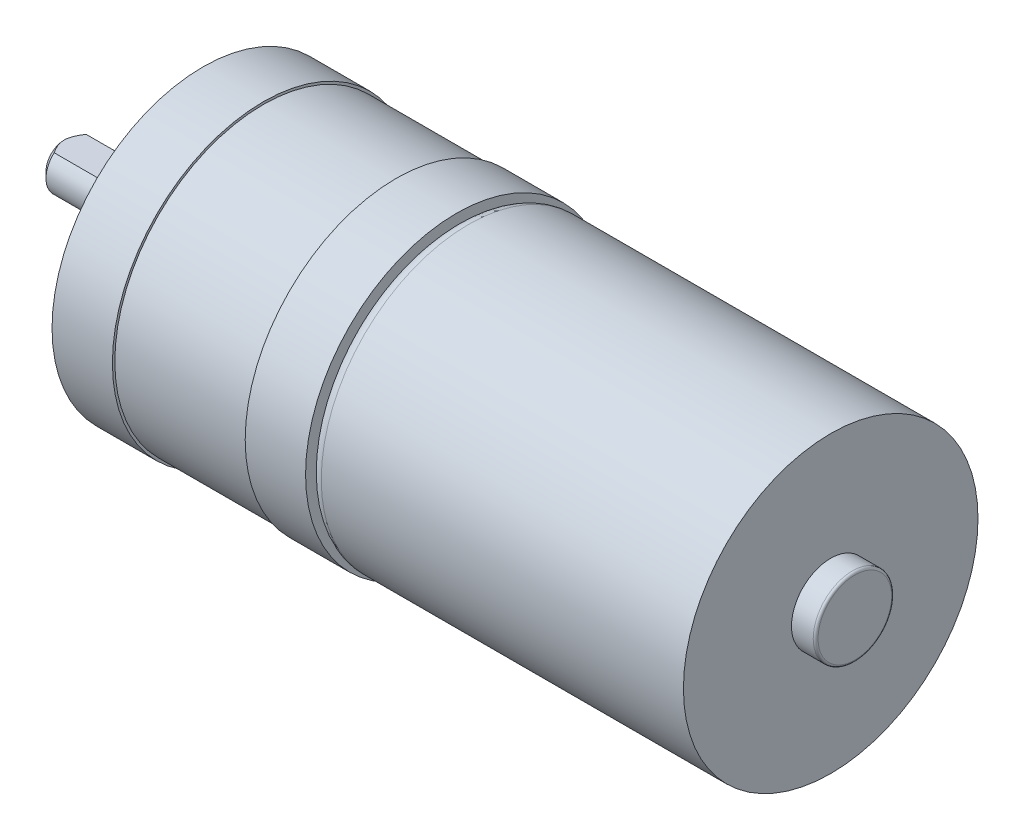
from build123d import *

# Parameters (mm, degrees)
CUT_EXTRUDE1_START = -8
CUT_EXTRUDE1_DEPTH = 8


with BuildPart() as part:
    # Sketch1 → Revolve1 (revolve)
    with BuildSketch(Plane.XY, mode=Mode.PRIVATE) as revolve1_sk:
        with BuildLine():
            Line((-9.946660926, -3.531651516), (-9.946660926, -12.5))
            Line((-9.946660926, -12.5), (-4.946660926, -12.5))
            Line((-4.946660926, -12.5), (-4.946660926, -12.3))
            Line((-4.946660926, -12.3), (6.053339074, -12.3))
            Line((6.053339074, -12.3), (6.053339074, -12.5))
            Line((6.053339074, -12.5), (11.053339074, -12.5))
            Line((11.053339074, -12.5), (11.053339074, -11.2))
            ThreePointArc((11.053339074, -11.2), (11.346232293, -11.907106781), (12.053339074, -12.2))
            Line((12.053339074, -12.2), (42.053339074, -12.2))
            Line((42.053339074, -12.2), (42.053339074, -3.25))
            Line((42.053339074, -3.25), (43.853339074, -3.25))
            ThreePointArc((43.853339074, -3.25), (43.99476043, -3.191421356), (44.053339074, -3.05))
            Line((44.053339074, -3.05), (44.053339074, 0))
            Line((44.053339074, 0), (-21.446660926, 0))
            Line((-21.446660926, 0), (-21.446660926, -1.5))
            Line((-21.446660926, -1.5), (-20.946660926, -2))
            Line((-20.946660926, -2), (-12.446660926, -2))
            Line((-12.446660926, -2), (-12.446660926, -3.531651516))
            Line((-12.446660926, -3.531651516), (-9.946660926, -3.531651516))
        make_face()
    revolve(revolve1_sk.sketch.rotate(Axis((-21.446660926, 0, 0), (1, 0, 0)), 270), axis=Axis((-21.446660926, 0, 0), (1, 0, 0)))

    # Sketch2 → Cut-Extrude1 (cut)
    with BuildSketch(Plane.ZY.offset(21.446660926).offset(CUT_EXTRUDE1_START)):
        with BuildLine():
            Line((-1.322875656, 1.5), (1.322875656, 1.5))
            ThreePointArc((1.322875656, 1.5), (0, 2), (-1.322875656, 1.5))
        make_face()
    extrude(amount=CUT_EXTRUDE1_DEPTH, mode=Mode.SUBTRACT)


solid = part.part
